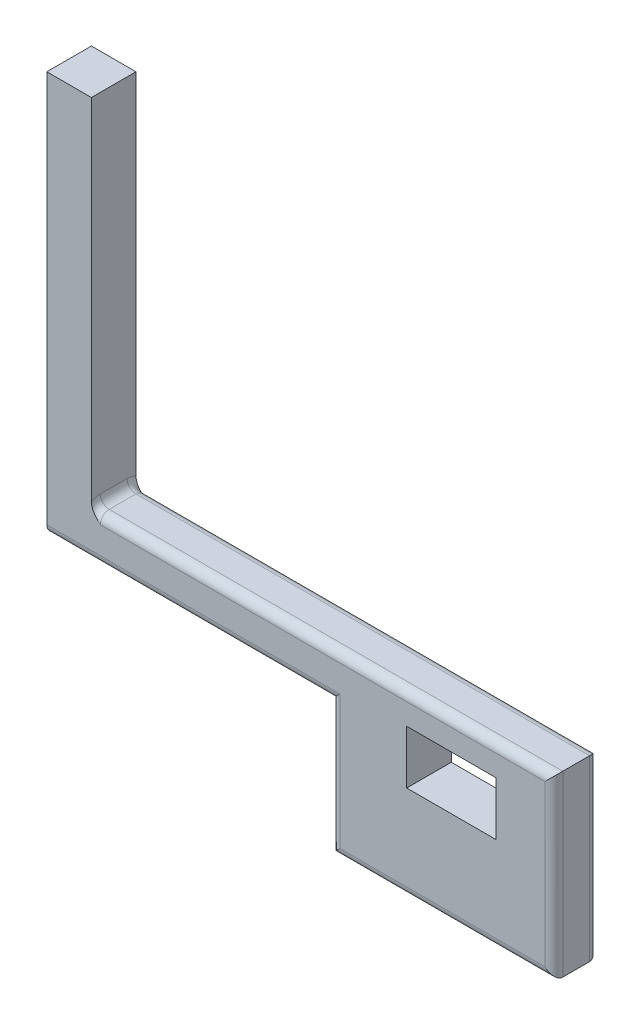
from build123d import *

# Parameters (mm, degrees)
SKETCH1_W           = 5
SKETCH1_H           = 5
BOSS_EXTRUDE1_DEPTH = 40
SKETCH2_W           = 51.86
SKETCH2_H           = 5
SKETCH2_W_2         = 5
BOSS_EXTRUDE3_DEPTH = 5
SKETCH4_W           = 25
SKETCH4_H           = 5
BOSS_EXTRUDE4_DEPTH = 15
FILLET1_R           = 1
FILLET2_R           = 1
FILLET3_R           = 1
SKETCH5_W           = 10
SKETCH5_H           = 6
CUT_EXTRUDE1_DEPTH  = 70.699782068


with BuildPart() as part:
    # Sketch1 → Boss-Extrude1 (new body)
    with BuildSketch(Plane(origin=(0, 0, 0), x_dir=(1, 0, 0), z_dir=(0, 1, 0))):
        with Locations((2.5, 2.5)):
            Rectangle(SKETCH1_W, SKETCH1_H)
    extrude(amount=BOSS_EXTRUDE1_DEPTH)

    # Sketch2 → Boss-Extrude3 (add)
    with BuildSketch(Plane.XZ):
        with Locations((30.93, -2.5)):
            Rectangle(SKETCH2_W, SKETCH2_H)
        with Locations((2.5, -2.5)):
            Rectangle(SKETCH2_W_2, SKETCH2_H)
    extrude(amount=BOSS_EXTRUDE3_DEPTH)

    # Sketch4 → Boss-Extrude4 (add)
    with BuildSketch(Plane.XZ.offset(5)):
        with Locations((44.36, -2.5)):
            Rectangle(SKETCH4_W, SKETCH4_H)
    extrude(amount=BOSS_EXTRUDE4_DEPTH)

    # Fillet1
    fillet1_edges = [part.edges().sort_by_distance(p)[0] for p in [
        (15.93, -5, 0),
        (56.86, -10, 0),
        (30.93, 0, 0),
        (31.86, -12.5, 0),
        (44.36, -20, 0),
    ]]
    fillet(fillet1_edges, radius=FILLET1_R)

    # Fillet2
    fillet2_edges = [part.edges().sort_by_distance(p)[0] for p in [
        (56.86, -10, -5),
        (30.93, 0, -5),
        (15.93, -5, -5),
        (31.86, -12.5, -5),
        (44.36, -20, -5),
    ]]
    fillet(fillet2_edges, radius=FILLET2_R)

    # Fillet3
    fillet3_edges = [part.edges().sort_by_distance(p)[0] for p in [
        (5, 0, -2.5),
        (5, -0.292893219, -0.292893219),
        (5, -0.292893219, -4.707106781),
    ]]
    fillet(fillet3_edges, radius=FILLET3_R)

    # Sketch5 → Cut-Extrude1 (cut, through all)
    with BuildSketch(Plane(origin=(0, 0, -5), x_dir=(-1, 0, 0), z_dir=(0, 0, -1))):
        with Locations((-45.36, -6.38)):
            Rectangle(SKETCH5_W, SKETCH5_H)
    extrude(amount=-CUT_EXTRUDE1_DEPTH, mode=Mode.SUBTRACT)


solid = part.part
